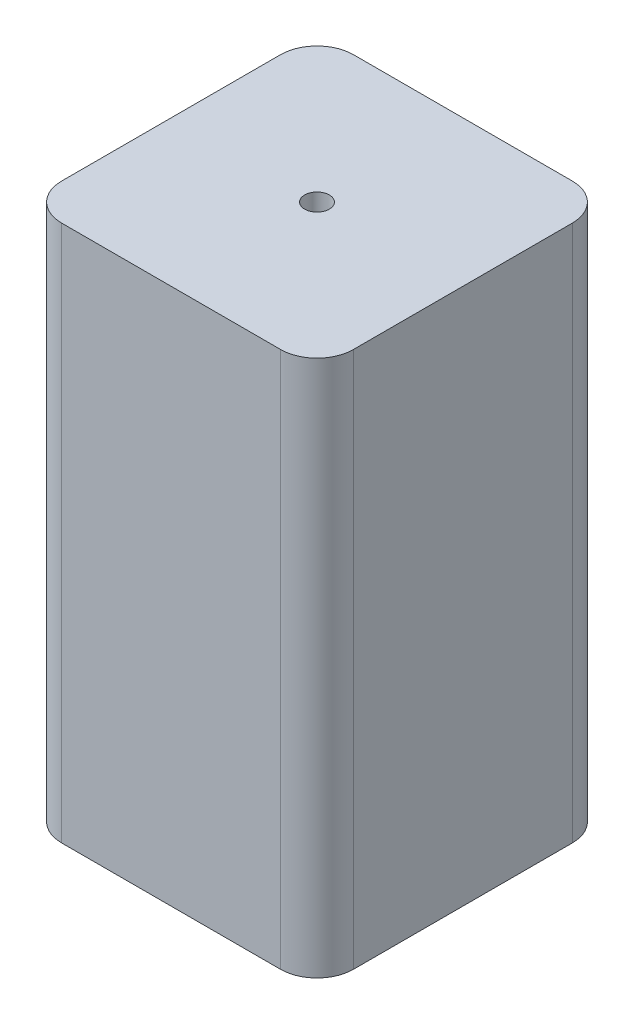
from build123d import *

# Parameters (mm, degrees)
SKETCH1_W           = 50
SKETCH1_H           = 50
BOSS_EXTRUDE1_DEPTH = 92
SKETCH2_R           = 2.115
CUT_EXTRUDE1_DEPTH  = 20
FILLET1_R           = 6.25


with BuildPart() as part:
    # Sketch1 → Boss-Extrude1 (new body)
    with BuildSketch(Plane(origin=(0, 0, 0), x_dir=(1, 0, 0), z_dir=(0, 1, 0))):
        Rectangle(SKETCH1_W, SKETCH1_H)
    extrude(amount=BOSS_EXTRUDE1_DEPTH)

    # Sketch2 → Cut-Extrude1 (cut)
    with BuildSketch(Plane(origin=(0, 92, 0), x_dir=(1, 0, 0), z_dir=(0, 1, 0))):
        with Locations(Location((0, 0, 0), (0, 0, 270))):
            Circle(SKETCH2_R)
    extrude(amount=-CUT_EXTRUDE1_DEPTH, mode=Mode.SUBTRACT)

    # Fillet1
    fillet1_edges = [part.edges().sort_by_distance(p)[0] for p in [
        (-25, 46, -25),
        (25, 46, -25),
        (25, 46, 25),
        (-25, 46, 25),
    ]]
    fillet(fillet1_edges, radius=FILLET1_R)


solid = part.part
